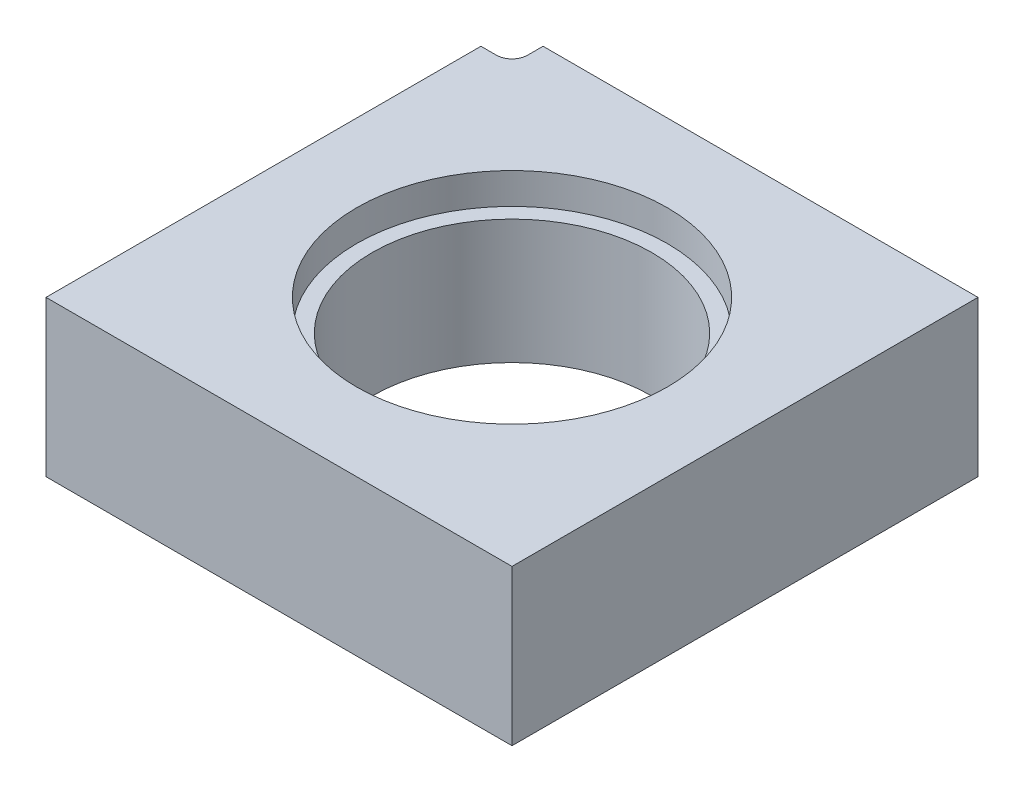
from build123d import *

# Parameters (mm, degrees)
SKETCH1_W           = 150
SKETCH1_H           = 150
BOSS_EXTRUDE1_DEPTH = 50
SKETCH2_R           = 50
CUT_EXTRUDE1_DEPTH  = 10
SKETCH3_R           = 45
CUT_EXTRUDE2_DEPTH  = 114.357840488
SKETCH4_W           = 10
SKETCH4_H           = 10
CUT_EXTRUDE3_DEPTH  = 45
SKETCH6_R           = 2.55
CUT_EXTRUDE4_DEPTH  = 5
FILLET1_R           = 5


with BuildPart() as part:
    # Sketch1 → Boss-Extrude1 (new body)
    with BuildSketch(Plane(origin=(0, 0, 0), x_dir=(1, 0, 0), z_dir=(0, 1, 0))):
        Rectangle(SKETCH1_W, SKETCH1_H)
    extrude(amount=BOSS_EXTRUDE1_DEPTH)

    # Sketch2 → Cut-Extrude1 (cut)
    with BuildSketch(Plane(origin=(0, 50, 0), x_dir=(1, 0, 0), z_dir=(0, 1, 0))):
        with Locations(Location((0, 0, 0), (0, 0, 270))):
            Circle(SKETCH2_R)
    extrude(amount=-CUT_EXTRUDE1_DEPTH, mode=Mode.SUBTRACT)

    # Sketch3 → Cut-Extrude2 (cut, through all)
    with BuildSketch(Plane(origin=(0, 40, 0), x_dir=(1, 0, 0), z_dir=(0, 1, 0))):
        with Locations(Location((0, 0, 0), (0, 0, 270))):
            Circle(SKETCH3_R)
    extrude(amount=-CUT_EXTRUDE2_DEPTH, mode=Mode.SUBTRACT)

    # Sketch4 → Cut-Extrude3 (cut)
    with BuildSketch(Plane(origin=(0, 50, 0), x_dir=(1, 0, 0), z_dir=(0, 1, 0))):
        with Locations((-70, 70)):
            Rectangle(SKETCH4_W, SKETCH4_H)
    extrude(amount=-CUT_EXTRUDE3_DEPTH, mode=Mode.SUBTRACT)

    # Sketch6 → Cut-Extrude4 (cut)
    with BuildSketch(Plane(origin=(0, 5, 0), x_dir=(1, 0, 0), z_dir=(0, 1, 0))):
        with Locations(Location((-70, 70, 0), (0, 0, 270))):
            Circle(SKETCH6_R)
    extrude(amount=-CUT_EXTRUDE4_DEPTH, mode=Mode.SUBTRACT)

    # Fillet1
    fillet1_edges = [part.edges().sort_by_distance(p)[0] for p in [
        (-75, 2.5, -75),
        (-65, 27.5, -65),
    ]]
    fillet(fillet1_edges, radius=FILLET1_R)


solid = part.part
